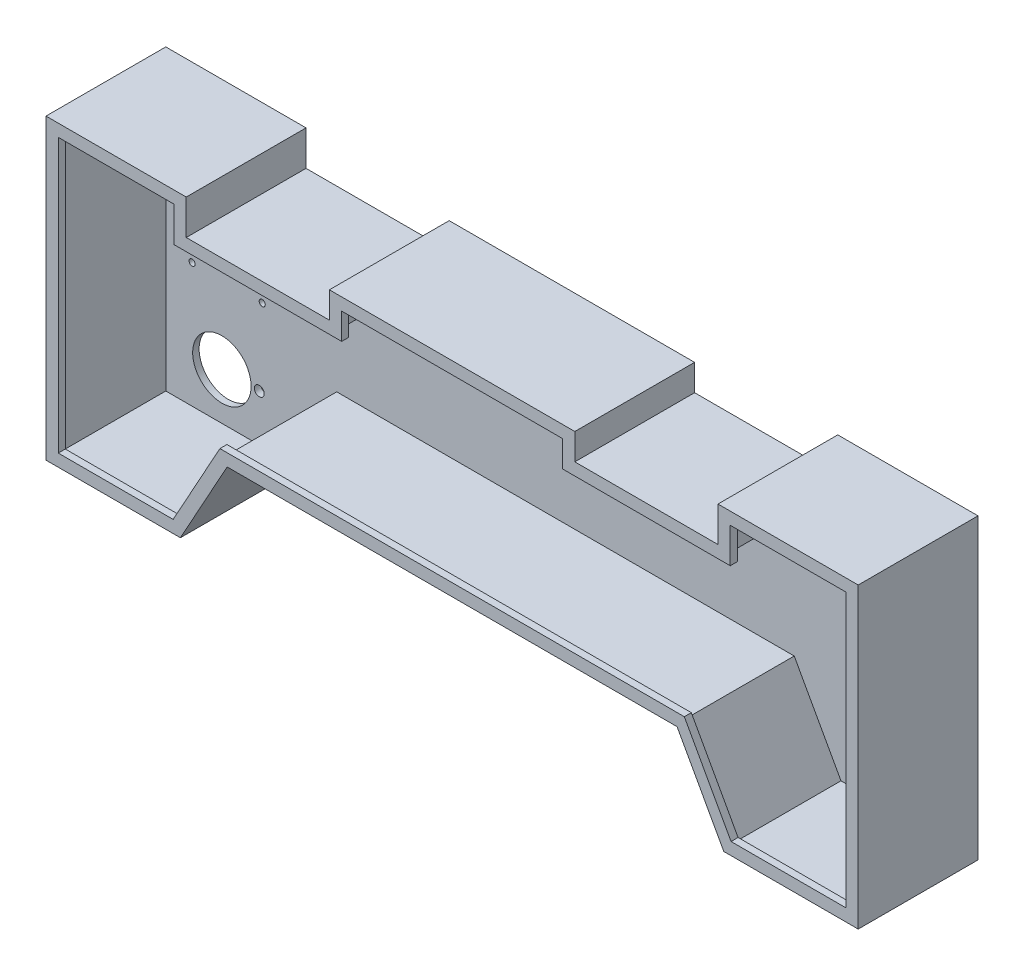
from build123d import *

# Parameters (mm, degrees)
EXTRUDE_1_DEPTH         = 20.5
SCALE_1_SCALE           = 10
SHELL_1_T               = -11
EXTRUDE_2_DEPTH         = 12
HOLE_WIZARD_17_0_17_1_D = 17
M12X1_25_2_D            = 10.5
F_12_0MM_1_D            = 12
SKETCH_27_R             = 50
CUT_EXTRUDE_1_DEPTH     = 11


with BuildPart() as part:
    # 草图1 → 凸台-拉伸1 (new body)
    with BuildSketch(Plane.XY):
        Polygon((-61.070262854, 36.5), (-37.070262854, 36.5), (-37.070262854, 30.5), (-12.570262854, 30.5), (-12.570262854, 35), (29.429737146, 35), (29.429737146, 30.5), (53.929737146, 30.5), (53.929737146, 36.5), (77.929737146, 36.5), (77.929737146, -14.5), (54.929737146, -14.5), (46.929737146, 0), (-30.070262854, 0), (-38.070262854, -14.5), (-61.070262854, -14.5), align=None)
    extrude(amount=EXTRUDE_1_DEPTH)


with BuildPart() as part_1:
    # 缩放比例1: scaled about (8.429737146, 13.654642846, 10.25)
    add(part.part.scale(SCALE_1_SCALE).moved(Location((-75.867634314, -122.891785614, -92.25))))

    # 抽壳1
    shell_1_openings = [part_1.faces().sort_by_distance(p)[0] for p in [
        (8.429737147, 13.654642849, 112.75),
    ]]
    offset(amount=SHELL_1_T, openings=shell_1_openings, kind=Kind.INTERSECTION)

    # 草图12 → 凸台-拉伸2 (add)
    with BuildSketch(Plane.XY.offset(112.75)):
        Polygon((-675.570262854, 231.108214383), (-675.570262854, -256.891785617), (-463.064431597, -256.891785617), (-383.064431597, -111.891785617), (399.923905889, -111.891785617), (479.923905889, -256.891785617), (692.429737146, -256.891785617), (692.429737146, 231.108214383), (474.429737146, 231.108214383), (474.429737146, 171.108214383), (207.429737146, 171.108214383), (207.429737146, 216.108214383), (-190.570262854, 216.108214383), (-190.570262854, 171.108214383), (-457.570262854, 171.108214383), (-457.570262854, 231.108214383), align=None)
        Polygon((-665.570262854, 221.108214383), (-665.570262854, -246.891785617), (-468.968221364, -246.891785617), (-388.968221364, -101.891785617), (405.827695656, -101.891785617), (485.827695656, -246.891785617), (682.429737146, -246.891785617), (682.429737146, 221.108214383), (484.429737146, 221.108214383), (484.429737146, 161.108214383), (197.429737146, 161.108214383), (197.429737146, 206.108214383), (-180.570262854, 206.108214383), (-180.570262854, 161.108214383), (-467.570262854, 161.108214383), (-467.570262854, 221.108214383), align=None, mode=Mode.SUBTRACT)
    extrude(amount=-EXTRUDE_2_DEPTH)

    # Ø17.0 (17) 直径孔1 (through all)
    with Locations(Plane.XY.offset(-81.25)):
        with Locations((-505.570262854, 141.108214383), (-630.570262854, 36.108214383), (-515.570262854, -176.891785617), (647.429737146, 36.108214383), (522.429737146, 136.108214383), (532.429737146, -176.891785617)):
            Hole(HOLE_WIZARD_17_0_17_1_D / 2)

    # M12x1.25 螺纹孔2 (through all)
    with Locations(Plane.XY.offset(-81.25)):
        with Locations((-630.570262854, -43.891785617), (-510.570262854, -43.891785617), (527.429737146, -43.891785617), (647.429737146, -43.891785617)):
            Hole(M12X1_25_2_D / 2)

    # Ø12.0mm 暗销孔1 (through all)
    with Locations(Plane(origin=(-630.570262854, 201.108214383, -81.25), x_dir=(1, 0, 0), z_dir=(0, 0, 1))):
        with Locations((0, 0), (120, 0), (1158, 0), (1278, 0)):
            Hole(F_12_0MM_1_D / 2)

    # 草图27 → 切除-拉伸1 (cut)
    with BuildSketch(Plane.XY.offset(-81.25)):
        with Locations((572.429737146, -176.891785617)):
            Circle(SKETCH_27_R)
        with Locations((-579.570262855, -176.891785617)):
            Circle(SKETCH_27_R)
    extrude(amount=-CUT_EXTRUDE_1_DEPTH, mode=Mode.SUBTRACT)


solid = part_1.part
